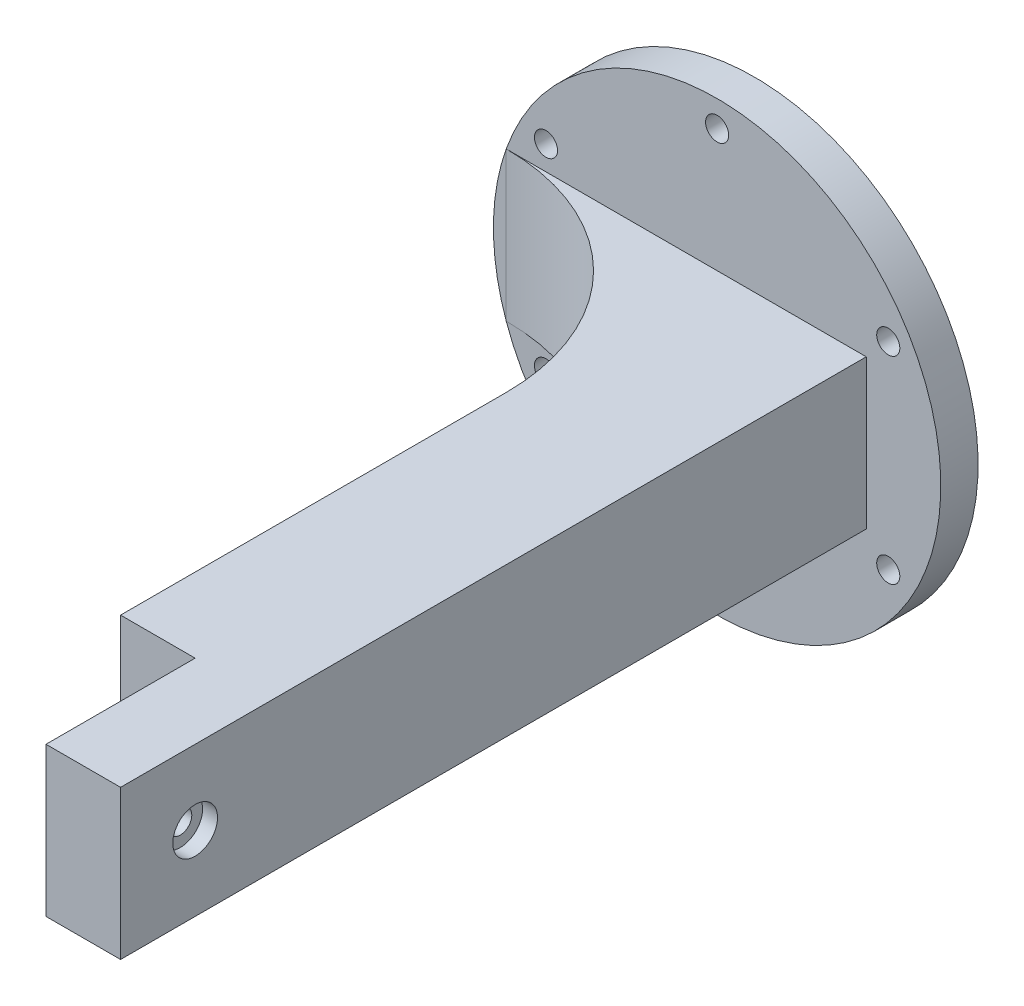
from build123d import *

# Parameters (mm, degrees)
SKETCH_1_W          = 20
SKETCH_1_H          = 20
EXTRUDE_1_DEPTH     = 140
SKETCH_2_R          = 30
SKETCH_2_R_2        = 1.55
EXTRUDE_2_DEPTH     = 5
SKETCH_3_W          = 28.284271248
SKETCH_3_H          = 20
EXTRUDE_3_DEPTH     = 28.28427125
CUT_EXTRUDE_1_DEPTH = 28.28427125
CUT_EXTRUDE_2_DEPTH = 28.28427125
CUT_EXTRUDE_3_DEPTH = 28.28427125
SKETCH_8_R          = 3
CUT_EXTRUDE_4_DEPTH = 2
SKETCH_9_R          = 2
CUT_EXTRUDE_5_DEPTH = 100
CUT_EXTRUDE_6_DEPTH = 3
CUT_EXTRUDE_7_DEPTH = 3
SKETCH_12_W         = 20
SKETCH_12_H         = 20
SKETCH_12_R         = 2
EXTRUDE_5_DEPTH     = 3
CUT_EXTRUDE_START   = -35
SKETCH_13_R         = 2
CUT_EXTRUDE_8_DEPTH = 35
CUT_EXTRUDE_9_DEPTH = 3
EXTRUDE_START       = -35
EXTRUDE_6_DEPTH     = 35


with BuildPart() as part:
    # 草图1 → 凸台-拉伸1 (new body)
    with BuildSketch(Plane.XY):
        with Locations((-6.377546769, -6.820183169)):
            Rectangle(SKETCH_1_W, SKETCH_1_H)
    extrude(amount=EXTRUDE_1_DEPTH)

    # 草图2 → 凸台-拉伸2 (add)
    with BuildSketch(Plane(origin=(0, 0, 0), x_dir=(-1, 0, 0), z_dir=(0, 0, -1))):
        with Locations((16.377546769, -6.820183169)):
            Circle(SKETCH_2_R)
        with Locations((-6.572126431, 6.429816831)):
            Circle(SKETCH_2_R_2, mode=Mode.SUBTRACT)
        with Locations((16.377546769, 19.679816831)):
            Circle(SKETCH_2_R_2, mode=Mode.SUBTRACT)
        with Locations((39.32721997, 6.429816831)):
            Circle(SKETCH_2_R_2, mode=Mode.SUBTRACT)
        with Locations((39.32721997, -20.070183169)):
            Circle(SKETCH_2_R_2, mode=Mode.SUBTRACT)
        with Locations((16.377546769, -33.320183169)):
            Circle(SKETCH_2_R_2, mode=Mode.SUBTRACT)
        with Locations((-6.572126431, -20.070183169)):
            Circle(SKETCH_2_R_2, mode=Mode.SUBTRACT)
    extrude(amount=EXTRUDE_2_DEPTH)

    # 草图3 → 凸台-拉伸3 (add)
    with BuildSketch(Plane.XY):
        with Locations((-30.519682393, -6.820183169)):
            Rectangle(SKETCH_3_W, SKETCH_3_H)
    extrude(amount=EXTRUDE_3_DEPTH)

    # 草图4 → 切除-拉伸1 (cut)
    with BuildSketch(Plane(origin=(0, 3.179816831, 0), x_dir=(1, 0, 0), z_dir=(0, 1, 0))):
        with BuildLine():
            Line((-44.661818017, -3e-09), (-44.661818017, -28.28427125))
            Line((-44.661818017, -28.28427125), (-16.377546769, -28.28427125))
            ThreePointArc((-16.377546769, -28.28427125), (-24.661818017, -8.28427125), (-44.661818017, -3e-09))
        make_face()
    extrude(amount=-CUT_EXTRUDE_1_DEPTH, mode=Mode.SUBTRACT)

    # 草图6 → 切除-拉伸2 (cut)
    with BuildSketch(Plane(origin=(0, 3.179816831, 0), x_dir=(1, 0, 0), z_dir=(0, 1, 0))):
        Polygon((3.622453231, -140), (3.622453231, -100), (-6.377546769, -100), (-6.377546769, -80), (-16.377546769, -80), (-16.377546769, -100), (-16.377546769, -140), align=None)
    extrude(amount=-CUT_EXTRUDE_2_DEPTH, mode=Mode.SUBTRACT)

    # 草图7 → 切除-拉伸3 (cut)
    with BuildSketch(Plane.ZY.offset(6.377546769)):
        with BuildLine():
            ThreePointArc((91.55, -6.820183169), (90.59315932, -5.388169893), (88.903984489, -5.724167658))
            Line((88.903984489, -5.724167658), (91.096015511, -7.91619868))
            ThreePointArc((91.096015511, -7.91619868), (91.432013275, -7.413342489), (91.55, -6.820183169))
        make_face()
        with BuildLine():
            Line((91.096015511, -7.91619868), (88.903984489, -5.724167658))
            ThreePointArc((88.903984489, -5.724167658), (88.903984489, -7.91619868), (91.096015511, -7.91619868))
        make_face()
    extrude(amount=-CUT_EXTRUDE_3_DEPTH, mode=Mode.SUBTRACT)

    # 草图8 → 切除-拉伸4 (cut)
    with BuildSketch(Plane(origin=(3.622453231, 0, 0), x_dir=(0, 0, -1), z_dir=(1, 0, 0))):
        with Locations(Location((-90, -6.820183169, 0), (0, 0, 90))):
            Circle(SKETCH_8_R)
    extrude(amount=-CUT_EXTRUDE_4_DEPTH, mode=Mode.SUBTRACT)

    # 草图9 → 切除-拉伸5 (cut)
    with BuildSketch(Plane.XY.offset(80)):
        with Locations((-11.377546769, -10.820183169)):
            Circle(SKETCH_9_R)
    extrude(amount=-CUT_EXTRUDE_5_DEPTH, mode=Mode.SUBTRACT)

    # 草图10 → 切除-拉伸6 (cut)
    with BuildSketch(Plane(origin=(0, 0, -5), x_dir=(-1, 0, 0), z_dir=(0, 0, -1))):
        Polygon((11.377546769, -10.820183169), (12.756937733, -12.268495932), (16.377546769, -8.820183169), (50.683077944, -8.820183169), (50.683077944, -4.820183169), (16.377546769, -4.820183169), (10.220185265, -9.18901728), align=None)
    extrude(amount=-CUT_EXTRUDE_6_DEPTH, mode=Mode.SUBTRACT)

    # 草图11 → 切除-拉伸7 (cut)
    with BuildSketch(Plane(origin=(0, 0, -5), x_dir=(-1, 0, 0), z_dir=(0, 0, -1))):
        Polygon((-3.622453231, -6.820183169), (-3.622453231, 3.179816831), (16.377546769, 3.179816831), (16.377546769, -16.820183169), (-3.622453231, -16.820183169), align=None)
    extrude(amount=-CUT_EXTRUDE_7_DEPTH, mode=Mode.SUBTRACT)

    # 草图12 → 凸台-拉伸5 (add)
    with BuildSketch(Plane(origin=(0, 0, -2), x_dir=(-1, 0, 0), z_dir=(0, 0, -1))):
        with Locations((6.377546769, -6.820183169)):
            Rectangle(SKETCH_12_W, SKETCH_12_H)
        with Locations(Location((11.377546769, -10.820183169, 0), (0, 0, 180))):
            Circle(SKETCH_12_R, mode=Mode.SUBTRACT)
    extrude(amount=EXTRUDE_5_DEPTH)

    # 草图13 → 切除-拉伸8 (cut)
    with BuildSketch(Plane(origin=(0, 0, -5), x_dir=(-1, 0, 0), z_dir=(0, 0, -1)).offset(CUT_EXTRUDE_START)):
        with Locations(Location((11.377546769, -10.820183169, 0), (0, 0, 180))):
            Circle(SKETCH_13_R)
        Polygon((-0.339967652, -4.345309435), (3.902673035, -0.102668747), (8.498867113, -4.698862825), (13.095061191, -9.295056903), (8.852420504, -13.53769759), (4.256226426, -8.941503512), align=None)
    extrude(amount=CUT_EXTRUDE_8_DEPTH, mode=Mode.SUBTRACT)

    # 草图14 → 切除-拉伸9 (cut)
    with BuildSketch(Plane(origin=(0, 0, -5), x_dir=(-1, 0, 0), z_dir=(0, 0, -1))):
        Polygon((13.095061191, -9.295056903), (16.377546769, -8.820183169), (16.377546769, -4.820183169), (9.60060106, -5.800596772), align=None)
    extrude(amount=-CUT_EXTRUDE_9_DEPTH, mode=Mode.SUBTRACT)

    # 草图15 → 凸台-拉伸6 (add)
    with BuildSketch(Plane(origin=(0, 0, -5), x_dir=(-1, 0, 0), z_dir=(0, 0, -1)).offset(EXTRUDE_START)):
        with BuildLine():
            Line((10.062802613, -12.32731548), (12.884679081, -9.505439013))
            ThreePointArc((12.884679081, -9.505439013), (12.791760332, -12.234396731), (10.062802613, -12.32731548))
        make_face()
    extrude(amount=EXTRUDE_6_DEPTH)


solid = part.part
